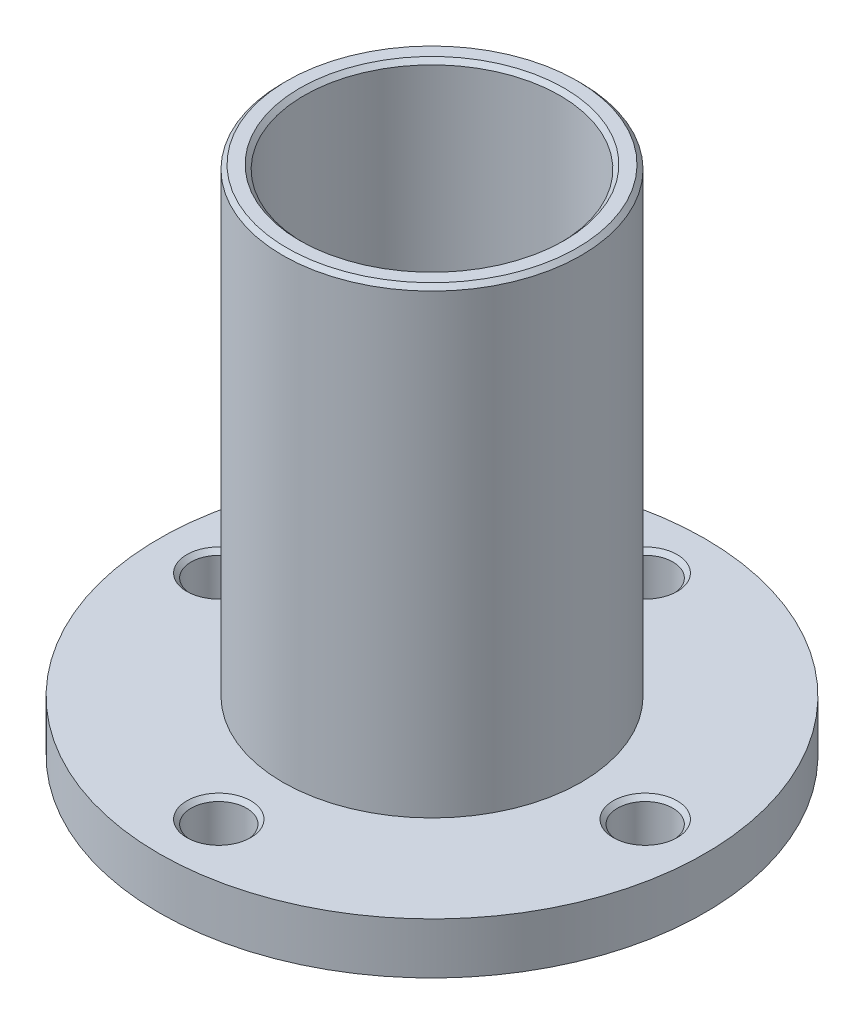
from build123d import *

# Parameters (mm, degrees)
CHAMFER1_SIZE      = 0.5
SKETCH2_R          = 3.25
CUT_EXTRUDE1_DEPTH = 71.455659815
CHAMFER2_SIZE      = 0.5
CHAMFER3_SIZE      = 0.5


with BuildPart() as part:
    # Sketch1 → Revolve1 (revolve)
    with BuildSketch(Plane.XY, mode=Mode.PRIVATE) as revolve1_sk:
        Polygon((-15, 2.3), (-15, 60), (-17.5, 60), (-17.5, 6), (-32, 6), (-32, 0), (-20, 0), (-20, 2.3), align=None)
    revolve(revolve1_sk.sketch.rotate(Axis((0, 0, 0), (0, 1, 0)), 270), axis=Axis((0, 0, 0), (0, 1, 0)))

    # Chamfer1
    chamfer1_edges = [part.edges().sort_by_distance(p)[0] for p in [
        (0, 60, 17.5),
        (0, 60, 15),
    ]]
    chamfer(chamfer1_edges, length=CHAMFER1_SIZE)

    # Sketch2 → Cut-Extrude1 (cut, through all)
    with BuildSketch(Plane(origin=(0, 6, 0), x_dir=(1, 0, 0), z_dir=(0, 1, 0))):
        with Locations(Location((0, 25, 0), (0, 0, 270))):
            Circle(SKETCH2_R)
        with Locations(Location((25, 0, 0), (0, 0, 270))):
            Circle(SKETCH2_R)
        with Locations(Location((0, -25, 0), (0, 0, 270))):
            Circle(SKETCH2_R)
        with Locations(Location((-25, 0, 0), (0, 0, 270))):
            Circle(SKETCH2_R)
    extrude(amount=-CUT_EXTRUDE1_DEPTH, mode=Mode.SUBTRACT)

    # Chamfer2
    chamfer2_edges = [part.edges().sort_by_distance(p)[0] for p in [
        (0, 0, -28.25),
        (0, 6, -28.25),
        (25, 0, -3.25),
        (25, 6, -3.25),
        (0, 0, 21.75),
        (0, 6, 21.75),
        (-25, 0, -3.25),
        (-25, 6, -3.25),
    ]]
    chamfer(chamfer2_edges, length=CHAMFER2_SIZE)

    # Chamfer3
    chamfer3_edges = [part.edges().sort_by_distance(p)[0] for p in [
        (0, 2.3, 15),
    ]]
    chamfer(chamfer3_edges, length=CHAMFER3_SIZE)


solid = part.part
